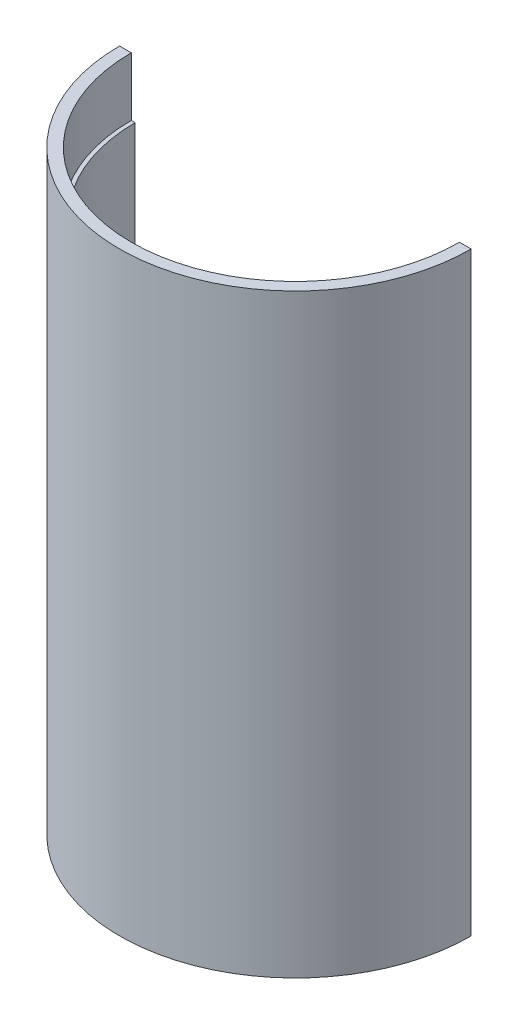
from build123d import *

# Parameters (mm, degrees)
REVOLVE1_ANGLE     = 180
SKETCH2_R          = 10.45
CUT_EXTRUDE1_DEPTH = 166.061473397


with BuildPart() as part:
    # Sketch1 → Revolve1 (revolve)
    with BuildSketch(Plane.XY):
        Polygon((-45, 0), (-45, 152.3), (-42, 152.3), (-42, 137.3), (-41, 137.3), (-41, 15), (-43, 15), (-43, 0), align=None)
    revolve(axis=Axis((0, 0, 0), (0, 1, 0)), revolution_arc=REVOLVE1_ANGLE)

    # Sketch2 → Cut-Extrude1 (cut, through all)
    with BuildSketch(Plane(origin=(0, 0, 0), x_dir=(0, 0, -1), z_dir=(1, 0, 0))):
        with Locations((0, 40.3)):
            Circle(SKETCH2_R)
        with Locations((0, 91.5)):
            Circle(SKETCH2_R)
    extrude(amount=-CUT_EXTRUDE1_DEPTH, mode=Mode.SUBTRACT)


solid = part.part
